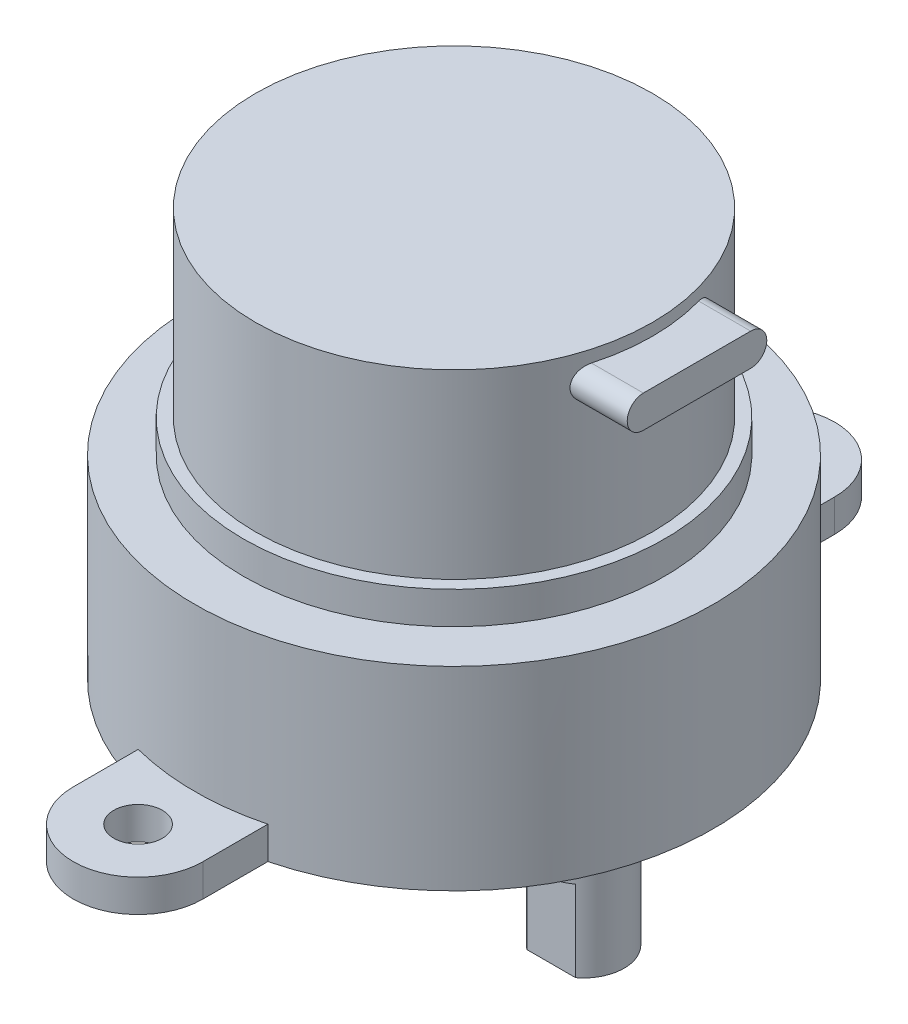
from build123d import *

# Parameters (mm, degrees)
SKETCH_9_W          = 5.698212476
SKETCH_9_H          = 1.620294685
SKETCH_9_W_2        = 7.400009417
SKETCH_9_H_2        = 3.482357373
CUT_EXTRUDE_1_DEPTH = 5
SKETCH_10_R         = 1.5
EXTRUDE_5_DEPTH     = 2
EXTRUDE_6_DEPTH     = 15


with BuildPart() as part:
    # 草图3 → 旋转1 (revolve)
    with BuildSketch(Plane.XY, mode=Mode.PRIVATE) as revolve_1_sk:
        Polygon((-16, 0), (-16, 12), (-13, 12), (-13, 14), (-12.25, 14), (-12.25, 25.2), (0, 25.2), (0, 0), align=None)
    revolve(revolve_1_sk.sketch.rotate(Axis((0, 0, 0), (0, 1, 0)), 270), axis=Axis((0, 0, 0), (0, 1, 0)))



with BuildPart() as body_2:
    # 草图6 → 旋转4 (revolve)
    with BuildSketch(Plane.XY):
        Polygon((3.5, 0), (3.5, -1.25), (4, -1.25), (4, -2.7), (5.5, -2.7), (5.5, -10.2), (8, -10.2), (8, -5.2), (8, 0), align=None)
    revolve(axis=Axis((8, 0, 0), (0, -1, 0)))

    # 草图8 → M3 螺纹孔1 (revolve, cut)
    with BuildSketch(Plane(origin=(8, -10.2, 0), x_dir=(0, 0, -1), z_dir=(1, 0, 0))):
        Polygon((0, 0), (0, 8.251075774), (1.25, 7.5), (1.25, 0), align=None)
    revolve(axis=Axis((8, -16.55, 0), (0, 1, 0)), mode=Mode.SUBTRACT)

    # 草图9 → 切除-拉伸1 (cut)
    with BuildSketch(Plane.XZ.offset(10.2)):
        with Locations((8.176379841, 2.810147343)):
            Rectangle(SKETCH_9_W, SKETCH_9_H)
        with Locations((7.325481371, -3.741178687)):
            Rectangle(SKETCH_9_W_2, SKETCH_9_H_2)
    extrude(amount=-CUT_EXTRUDE_1_DEPTH, mode=Mode.SUBTRACT)


with BuildPart() as part_1:
    add(part.part)

    add(body_2.part)  # 凸台-拉伸5 merges body 2
    # 草图10 → 凸台-拉伸5 (add)
    with BuildSketch(Plane.XZ):
        with BuildLine():
            Line((-4, -19.5), (-4, 19.5))
            ThreePointArc((-4, 19.5), (0, 23.5), (4, 19.5))
            Line((4, 19.5), (4, -19.5))
            ThreePointArc((4, -19.5), (0, -23.5), (-4, -19.5))
        make_face()
        with Locations(Location((0, 19.5, 0), (0, 0, 270))):
            Circle(SKETCH_10_R, mode=Mode.SUBTRACT)
        with Locations(Location((0, -19.5, 0), (0, 0, 270))):
            Circle(SKETCH_10_R, mode=Mode.SUBTRACT)
    extrude(amount=-EXTRUDE_5_DEPTH)

    # 草图11 → 凸台-拉伸6 (add)
    with BuildSketch(Plane(origin=(0, 0, 0), x_dir=(0, 0, -1), z_dir=(1, 0, 0))):
        with BuildLine():
            Line((-3.311772074, 24.45726904), (3.311772074, 24.45726904))
            ThreePointArc((3.311772074, 24.45726904), (4.30779375, 23.461247363), (3.311772074, 22.465225687))
            Line((3.311772074, 22.465225687), (-3.311772074, 22.465225687))
            ThreePointArc((-3.311772074, 22.465225687), (-4.30779375, 23.461247363), (-3.311772074, 24.45726904))
        make_face()
    extrude(amount=EXTRUDE_6_DEPTH)


solid = part_1.part
